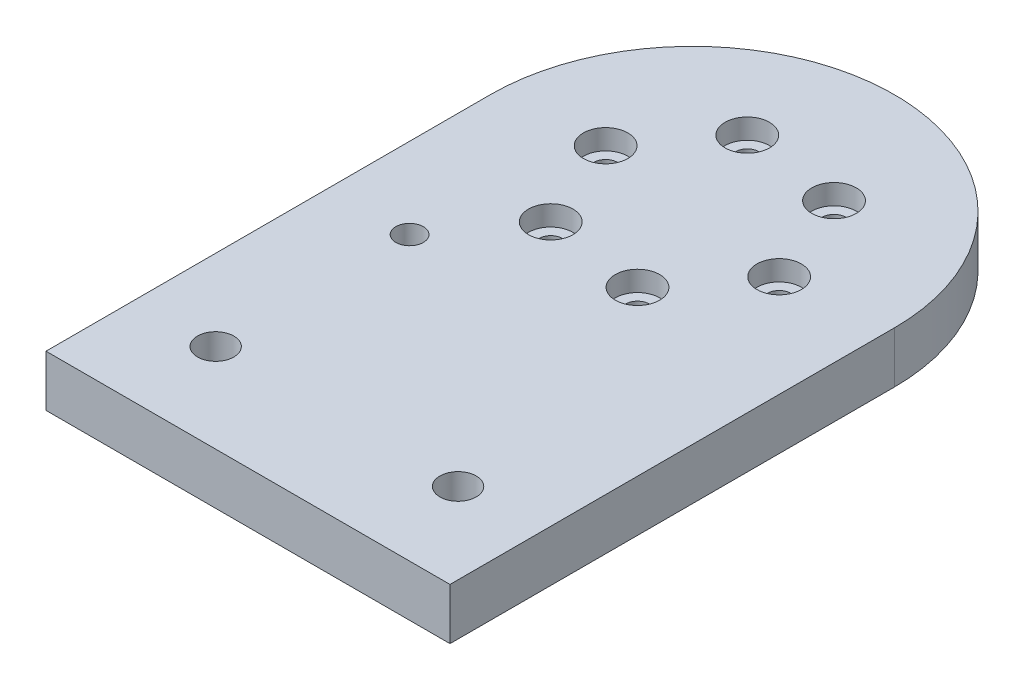
from build123d import *

# Parameters (mm, degrees)
PLACA_START                 = 34.5
SK_PLACA_W                  = 50
SK_PLACA_H                  = 36
PLACA_DEPTH                 = 6.35
EXTREMO_START               = 34.5
SK_EXTREMO_R                = 25
EXTREMO_DEPTH               = 6.35
PASANTES_M2_5_CUBO_J5_START = 34.5
SK_PASANTES_M2_5_CUBO_J5_R  = 1.45
PASANTES_M2_5_CUBO_J5_DEPTH = 6.35
CAJAS_M2_5_J5_START         = 38.35
SK_CAJAS_M2_5_J5_R          = 2.75
CAJAS_M2_5_J5_DEPTH         = 2.5
EXTENSION_PESTANAS_START    = 34.5
SK_EXTENSION_PESTANAS_W     = 50
SK_EXTENSION_PESTANAS_H     = 19
EXTENSION_PESTANAS_DEPTH    = 6.35
PASANTES_M4_REPISA_START    = 34.5
SK_PASANTES_M4_REPISA_R     = 2.25
PASANTES_M4_REPISA_DEPTH    = 6.35
PASANTE_M3_CINCHO_START     = 34.5
SK_PASANTE_M3_CINCHO_R      = 1.7
PASANTE_M3_CINCHO_DEPTH     = 6.35


with BuildPart() as part:
    # Sk_Placa → Placa (new body)
    with BuildSketch(Plane(origin=(0, 0, 0), x_dir=(1, 0, 0), z_dir=(0, 1, 0)).offset(PLACA_START)):
        with Locations((0, -508)):
            Rectangle(SK_PLACA_W, SK_PLACA_H)
    extrude(amount=PLACA_DEPTH)

    # Sk_Extremo → Extremo (add)
    with BuildSketch(Plane(origin=(0, 0, 0), x_dir=(1, 0, 0), z_dir=(0, 1, 0)).offset(EXTREMO_START)):
        with Locations((0, -490)):
            Circle(SK_EXTREMO_R)
    extrude(amount=EXTREMO_DEPTH)

    # Sk_Pasantes_M2-5_cubo_J5 → Pasantes_M2-5_cubo_J5 (cut)
    with BuildSketch(Plane(origin=(0, 0, 0), x_dir=(1, 0, 0), z_dir=(0, 1, 0)).offset(PASANTES_M2_5_CUBO_J5_START)):
        with Locations(Location((12.390194253, -491.653204878, 0), (0, 0, 270))):
            Circle(SK_PASANTES_M2_5_CUBO_J5_R)
        with Locations(Location((4.763379704, -501.55682542, 0), (0, 0, 270))):
            Circle(SK_PASANTES_M2_5_CUBO_J5_R)
        with Locations(Location((-7.626814549, -499.903620542, 0), (0, 0, 270))):
            Circle(SK_PASANTES_M2_5_CUBO_J5_R)
        with Locations(Location((-12.390194253, -488.346795122, 0), (0, 0, 270))):
            Circle(SK_PASANTES_M2_5_CUBO_J5_R)
        with Locations(Location((-4.763379704, -478.44317458, 0), (0, 0, 270))):
            Circle(SK_PASANTES_M2_5_CUBO_J5_R)
        with Locations(Location((7.626814549, -480.096379458, 0), (0, 0, 270))):
            Circle(SK_PASANTES_M2_5_CUBO_J5_R)
    extrude(amount=PASANTES_M2_5_CUBO_J5_DEPTH, mode=Mode.SUBTRACT)

    # Sk_Cajas_M2-5_J5 → Cajas_M2-5_J5 (cut)
    with BuildSketch(Plane(origin=(0, 0, 0), x_dir=(1, 0, 0), z_dir=(0, 1, 0)).offset(CAJAS_M2_5_J5_START)):
        with Locations(Location((12.390194253, -491.653204878, 0), (0, 0, 270))):
            Circle(SK_CAJAS_M2_5_J5_R)
        with Locations(Location((4.763379704, -501.55682542, 0), (0, 0, 270))):
            Circle(SK_CAJAS_M2_5_J5_R)
        with Locations(Location((-7.626814549, -499.903620542, 0), (0, 0, 270))):
            Circle(SK_CAJAS_M2_5_J5_R)
        with Locations(Location((-12.390194253, -488.346795122, 0), (0, 0, 270))):
            Circle(SK_CAJAS_M2_5_J5_R)
        with Locations(Location((-4.763379704, -478.44317458, 0), (0, 0, 270))):
            Circle(SK_CAJAS_M2_5_J5_R)
        with Locations(Location((7.626814549, -480.096379458, 0), (0, 0, 270))):
            Circle(SK_CAJAS_M2_5_J5_R)
    extrude(amount=CAJAS_M2_5_J5_DEPTH, mode=Mode.SUBTRACT)

    # Sk_Extension_pestanas → Extension_pestanas (add)
    with BuildSketch(Plane(origin=(0, 0, 0), x_dir=(1, 0, 0), z_dir=(0, 1, 0)).offset(EXTENSION_PESTANAS_START)):
        with Locations((0, -535.5)):
            Rectangle(SK_EXTENSION_PESTANAS_W, SK_EXTENSION_PESTANAS_H)
    extrude(amount=EXTENSION_PESTANAS_DEPTH)

    # Sk_Pasantes_M4_repisa → Pasantes_M4_repisa (cut)
    with BuildSketch(Plane(origin=(0, 0, 0), x_dir=(1, 0, 0), z_dir=(0, 1, 0)).offset(PASANTES_M4_REPISA_START)):
        with Locations(Location((-15, -534, 0), (0, 0, 270))):
            Circle(SK_PASANTES_M4_REPISA_R)
        with Locations(Location((15, -534, 0), (0, 0, 270))):
            Circle(SK_PASANTES_M4_REPISA_R)
    extrude(amount=PASANTES_M4_REPISA_DEPTH, mode=Mode.SUBTRACT)

    # Sk_Pasante_M3_cincho → Pasante_M3_cincho (cut)
    with BuildSketch(Plane(origin=(0, 0, 0), x_dir=(1, 0, 0), z_dir=(0, 1, 0)).offset(PASANTE_M3_CINCHO_START)):
        with Locations(Location((-15, -510, 0), (0, 0, 270))):
            Circle(SK_PASANTE_M3_CINCHO_R)
    extrude(amount=PASANTE_M3_CINCHO_DEPTH, mode=Mode.SUBTRACT)


solid = part.part
